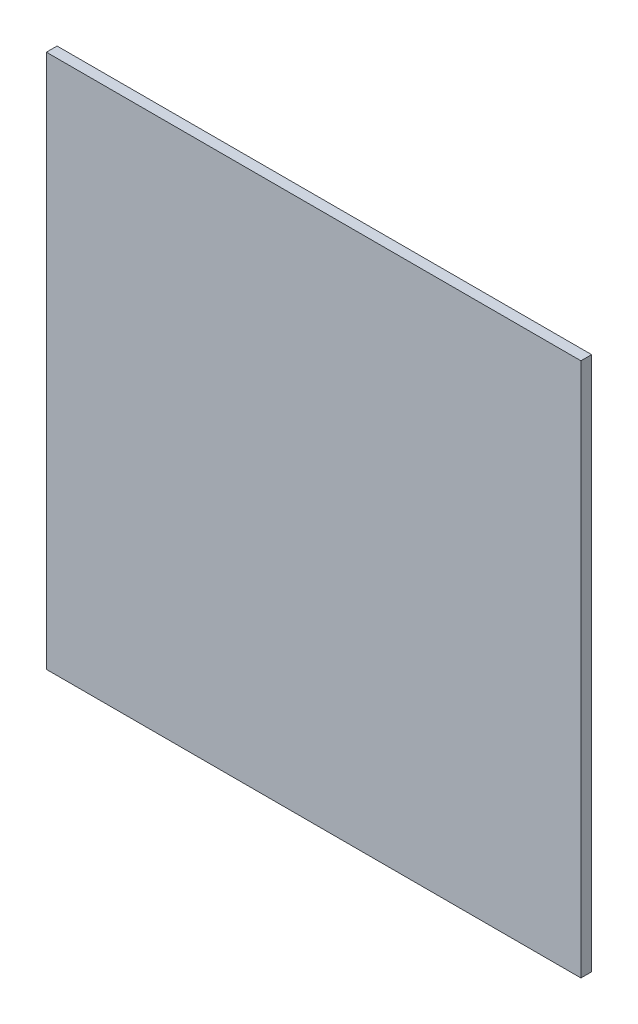
from build123d import *

# Parameters (mm, degrees)
SKETCH1_W           = 100
SKETCH1_H           = 100
BOSS_EXTRUDE1_DEPTH = 2


with BuildPart() as part:
    # Sketch1 → Boss-Extrude1 (new body)
    with BuildSketch(Plane.XY):
        Rectangle(SKETCH1_W, SKETCH1_H)
    extrude(amount=BOSS_EXTRUDE1_DEPTH)


solid = part.part
